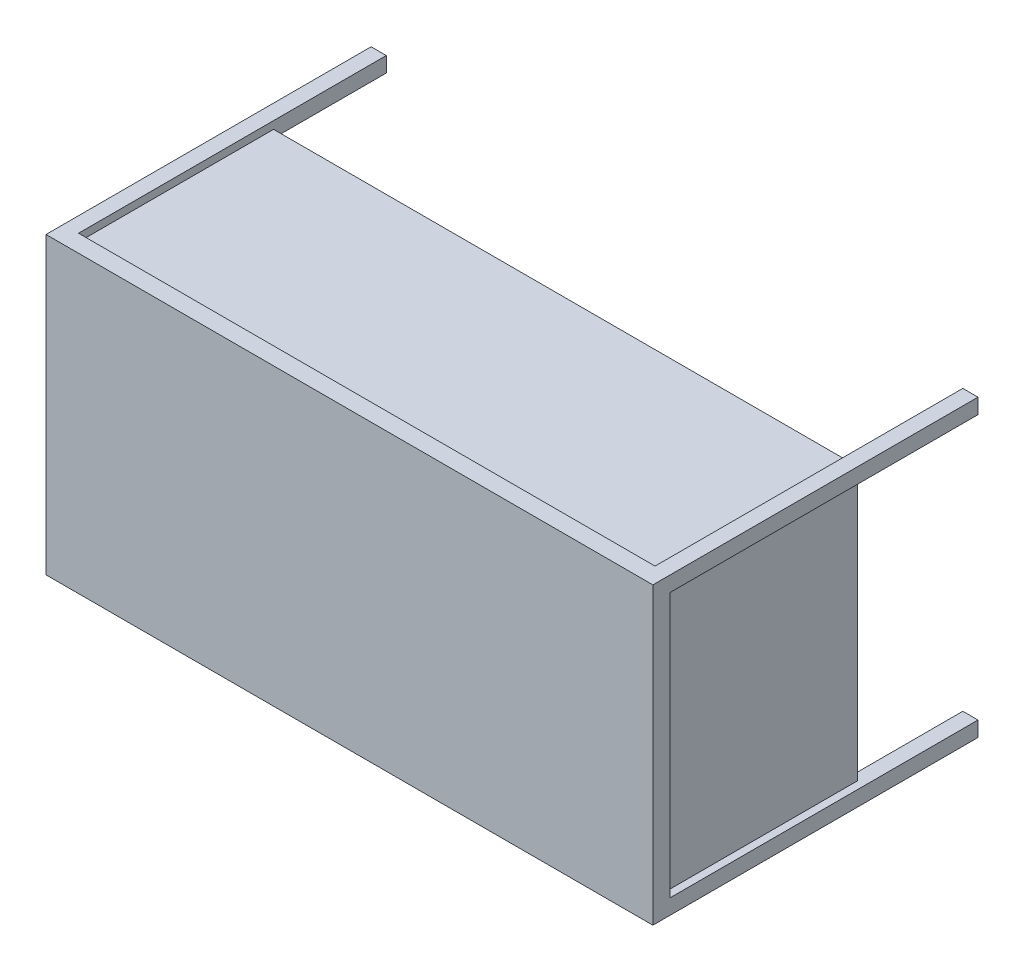
from build123d import *

# Parameters (mm, degrees)
SKIZZE1_W                       = 1400
SKIZZE1_H                       = 680
AUFSATZ_LINEAR_AUSTRAGEN1_DEPTH = 40
SKIZZE2_W                       = 35
SKIZZE2_H                       = 35
AUFSATZ_LINEAR_AUSTRAGEN2_DEPTH = 710
SKIZZE3_W                       = 1365
SKIZZE3_H                       = 645
AUFSATZ_LINEAR_AUSTRAGEN3_DEPTH = 450


with BuildPart() as part:
    # Skizze1 → Aufsatz-Linear austragen1 (new body)
    with BuildSketch(Plane.XY):
        with Locations((679.568580104, -330.209944633)):
            Rectangle(SKIZZE1_W, SKIZZE1_H)
    extrude(amount=AUFSATZ_LINEAR_AUSTRAGEN1_DEPTH)

    # Skizze2 → Aufsatz-Linear austragen2 (add)
    with BuildSketch(Plane(origin=(0, 0, 0), x_dir=(-1, 0, 0), z_dir=(0, 0, -1))):
        with Locations((-1362.068580104, -7.709944633)):
            Rectangle(SKIZZE2_W, SKIZZE2_H)
        with Locations((-1362.068580104, -652.709944633)):
            Rectangle(SKIZZE2_W, SKIZZE2_H)
        with Locations((2.931419896, -7.709944633)):
            Rectangle(SKIZZE2_W, SKIZZE2_H)
        with Locations((2.931419896, -652.709944633)):
            Rectangle(SKIZZE2_W, SKIZZE2_H)
    extrude(amount=AUFSATZ_LINEAR_AUSTRAGEN2_DEPTH)

    # Skizze3 → Aufsatz-Linear austragen3 (add)
    with BuildSketch(Plane(origin=(0, 0, 0), x_dir=(-1, 0, 0), z_dir=(0, 0, -1))):
        with Locations((-679.568580104, -330.209944633)):
            Rectangle(SKIZZE3_W, SKIZZE3_H)
    extrude(amount=AUFSATZ_LINEAR_AUSTRAGEN3_DEPTH)


solid = part.part
